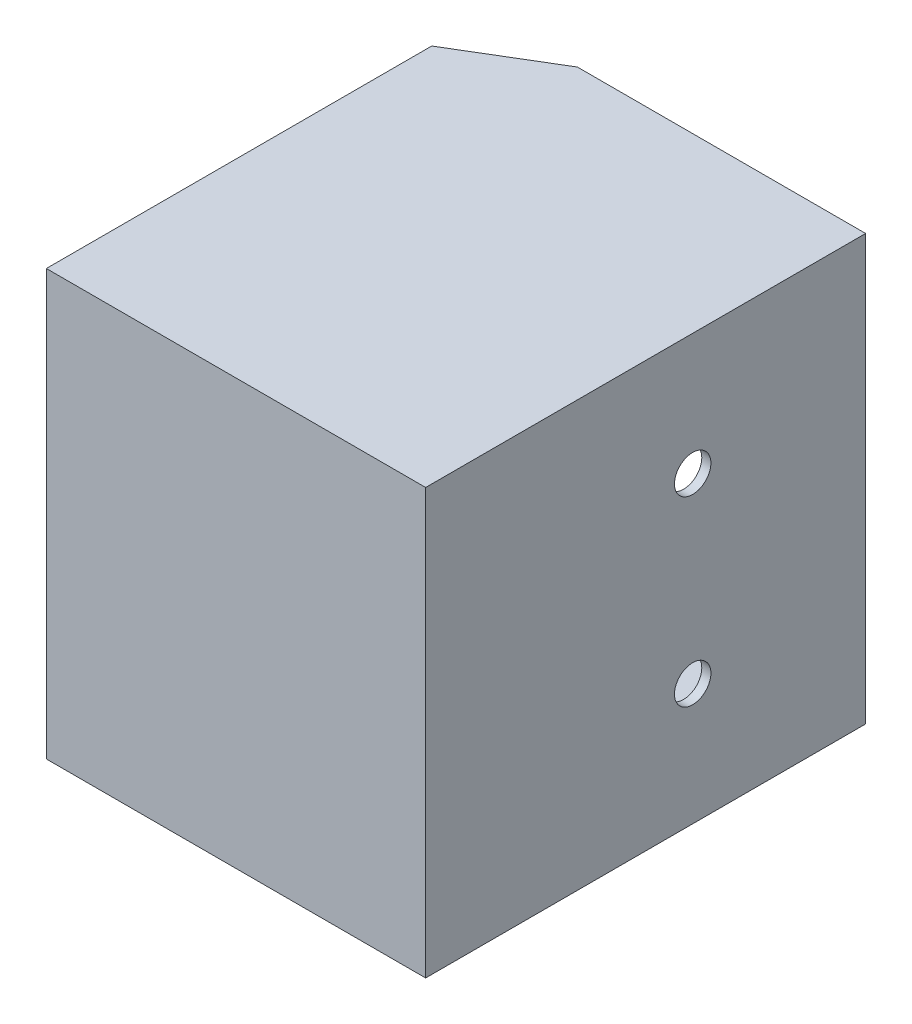
from build123d import *

# Parameters (mm, degrees)
SK_FRONT_W       = 145
SK_FRONT_H       = 140
SK_FRONT_R       = 6
FRONT_DEPTH      = 3
SK_BACK_W        = 127
SK_BACK_H        = 140
BACK_DEPTH       = 3
SK_TOP_W         = 125
SK_TOP_H         = 140
TOP_DEPTH        = 3
SIDE_L_DEPTH     = 3
SIDE_R_DEPTH     = 3
SK_HORN_PLATE_W  = 60
SK_HORN_PLATE_H  = 142
SK_HORN_PLATE_R  = 2
HORN_PLATE_DEPTH = 4


with BuildPart() as part:
    # SK_Front → Front (new body)
    with BuildSketch(Plane(origin=(67, 0, 0), x_dir=(0, 0, -1), z_dir=(1, 0, 0))):
        with Locations((-57.5, 0)):
            Rectangle(SK_FRONT_W, SK_FRONT_H)
        with Locations((-42, 30)):
            Circle(SK_FRONT_R, mode=Mode.SUBTRACT)
        with Locations((-42, -30)):
            Circle(SK_FRONT_R, mode=Mode.SUBTRACT)
    extrude(amount=FRONT_DEPTH)



with BuildPart() as body_2:
    # SK_Back → Back (new body)
    with BuildSketch(Plane(origin=(-55, 0, 0), x_dir=(0, 0, -1), z_dir=(1, 0, 0))):
        with Locations((-66.5, 0)):
            Rectangle(SK_BACK_W, SK_BACK_H)
    extrude(amount=BACK_DEPTH)


with BuildPart() as part_1:
    add(part.part)

    add(body_2.part)  # Top merges body 2
    # SK_Top → Top (add)
    with BuildSketch(Plane.XY.offset(127)):
        with Locations((7.5, 0)):
            Rectangle(SK_TOP_W, SK_TOP_H)
    extrude(amount=TOP_DEPTH)

    # SK_Side_L → Side_L (add)
    with BuildSketch(Plane(origin=(0, 67, 0), x_dir=(1, 0, 0), z_dir=(0, 1, 0))):
        Polygon((-25, 15), (70, 15), (70, -130), (-55, -130), (-55, -3), align=None)
    extrude(amount=SIDE_L_DEPTH)

    # SK_Side_R → Side_R (add)
    with BuildSketch(Plane(origin=(0, -70, 0), x_dir=(1, 0, 0), z_dir=(0, 1, 0))):
        Polygon((-25, 15), (70, 15), (70, -130), (-55, -130), (-55, -3), align=None)
    extrude(amount=SIDE_R_DEPTH)

    # SK_Horn_Plate → Horn_Plate (add)
    with BuildSketch(Plane(origin=(0, 20.5, 0), x_dir=(1, 0, 0), z_dir=(0, 1, 0))):
        with Locations((10, -59)):
            Rectangle(SK_HORN_PLATE_W, SK_HORN_PLATE_H)
        with Locations(Location((0, 0, 0), (0, 0, 270))):
            Circle(SK_HORN_PLATE_R, mode=Mode.SUBTRACT)
    extrude(amount=HORN_PLATE_DEPTH)


solid = part_1.part
